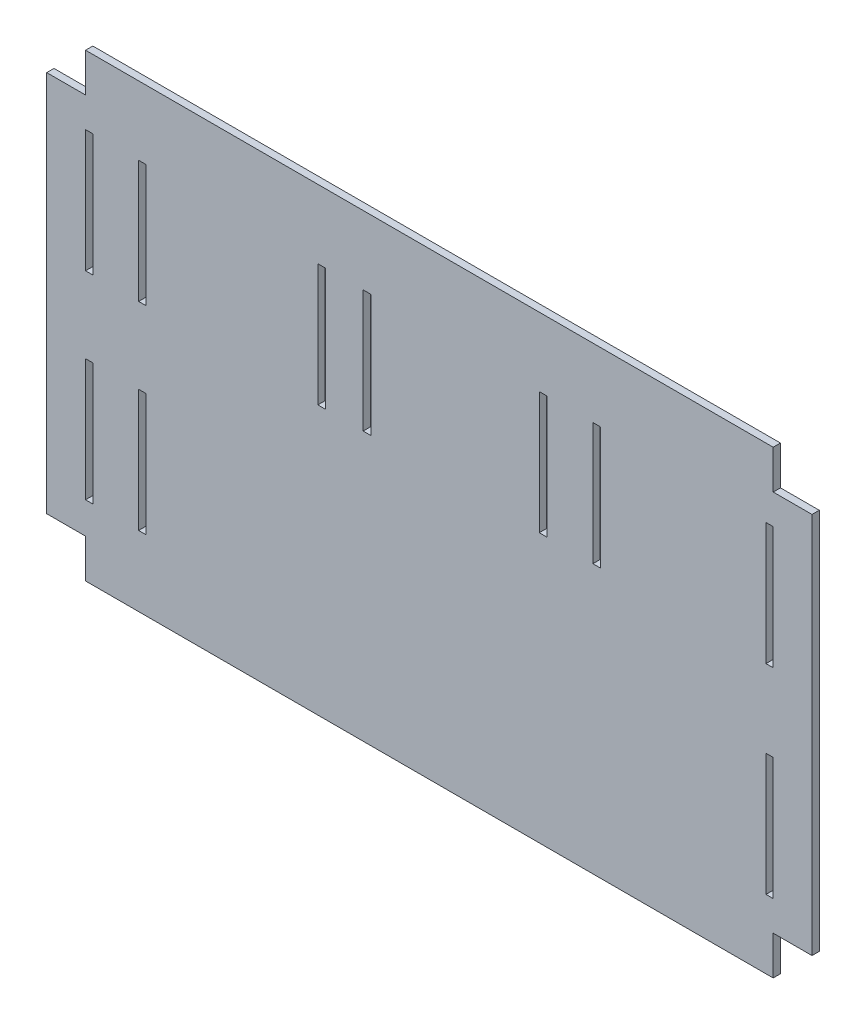
from build123d import *

# Parameters (mm, degrees)
SKETCH_1_W          = 500.8
SKETCH_1_H          = 300.8
EXTRUDE_1_DEPTH     = 4.75
SKETCH_2_W          = 25.4
SKETCH_2_H          = 25.4
SKETCH_2_W_2        = 4.75
SKETCH_2_H_2        = 80
SKETCH_2_W_3        = 5.096596069
CUT_EXTRUDE_1_DEPTH = 10


with BuildPart() as part:
    # 草圖1 → 填料-伸長1 (new body)
    with BuildSketch(Plane.XY):
        Rectangle(SKETCH_1_W, SKETCH_1_H)
    extrude(amount=EXTRUDE_1_DEPTH)

    # 草圖2 → 除料-伸長1 (cut)
    with BuildSketch(Plane(origin=(0, 0, 0), x_dir=(-1, 0, 0), z_dir=(0, 0, -1))):
        with Locations((-237.7, 137.7)):
            Rectangle(SKETCH_2_W, SKETCH_2_H)
        with Locations((-237.7, -137.7)):
            Rectangle(SKETCH_2_W, SKETCH_2_H)
        with Locations((237.7, 137.7)):
            Rectangle(SKETCH_2_W, SKETCH_2_H)
        with Locations((237.7, -137.7)):
            Rectangle(SKETCH_2_W, SKETCH_2_H)
        with Locations((-222.625, 65.4)):
            Rectangle(SKETCH_2_W_2, SKETCH_2_H_2)
        with Locations((-222.625, -65.4)):
            Rectangle(SKETCH_2_W_2, SKETCH_2_H_2)
        with Locations((222.625, 65.4)):
            Rectangle(SKETCH_2_W_2, SKETCH_2_H_2)
        with Locations((222.625, -64.4)):
            Rectangle(SKETCH_2_W_2, SKETCH_2_H_2)
        with Locations((187.875, 65.4)):
            Rectangle(SKETCH_2_W_2, SKETCH_2_H_2)
        with Locations((187.875, -64.4)):
            Rectangle(SKETCH_2_W_2, SKETCH_2_H_2)
        with Locations((-109.565361966, 65.4)):
            Rectangle(SKETCH_2_W_3, SKETCH_2_H_2)
        with Locations((-74.468765897, 65.4)):
            Rectangle(SKETCH_2_W_3, SKETCH_2_H_2)
        with Locations((40.781234104, 65.4)):
            Rectangle(SKETCH_2_W_3, SKETCH_2_H_2)
        with Locations((70.434638035, 65.4)):
            Rectangle(SKETCH_2_W_3, SKETCH_2_H_2)
    extrude(amount=-CUT_EXTRUDE_1_DEPTH, mode=Mode.SUBTRACT)


solid = part.part
